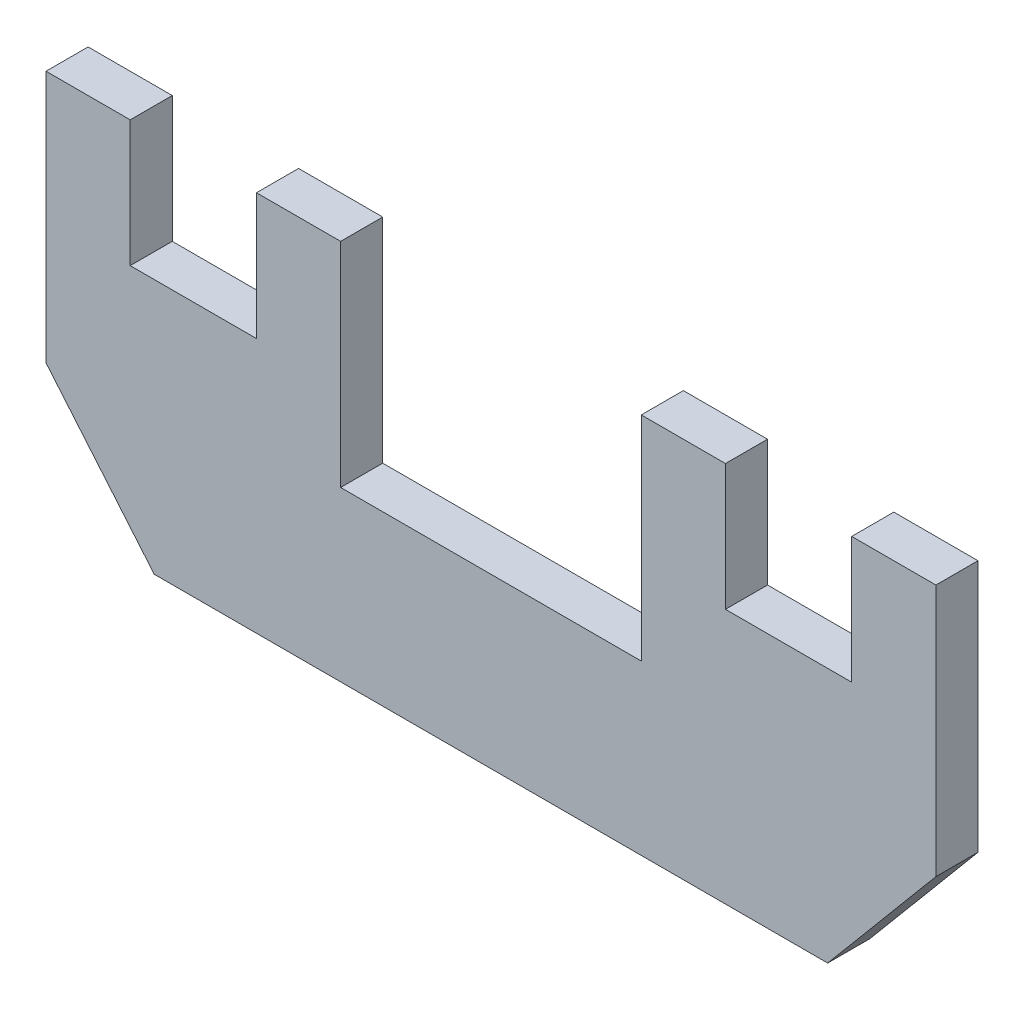
from build123d import *

# Parameters (mm, degrees)
BOSS_EXTRUDE1_DEPTH = 6.35


with BuildPart() as part:
    # Sketch1 → Boss-Extrude1 (new body)
    with BuildSketch(Plane.XY):
        Polygon((-50.8, 0), (50.8, 0), (67.126805286, 19.457528855), (67.126805286, 57.557528855), (54.426805286, 57.557528855), (54.426805286, 38.507528855), (35.376805286, 38.507528855), (35.376805286, 57.557528855), (22.676805286, 57.557528855), (22.676805286, 25.4), (-22.676805286, 25.4), (-22.676805286, 57.557528855), (-35.376805286, 57.557528855), (-35.376805286, 38.507528855), (-54.426805286, 38.507528855), (-54.426805286, 57.557528855), (-67.126805286, 57.557528855), (-67.126805286, 19.457528855), align=None)
    extrude(amount=BOSS_EXTRUDE1_DEPTH)


solid = part.part
